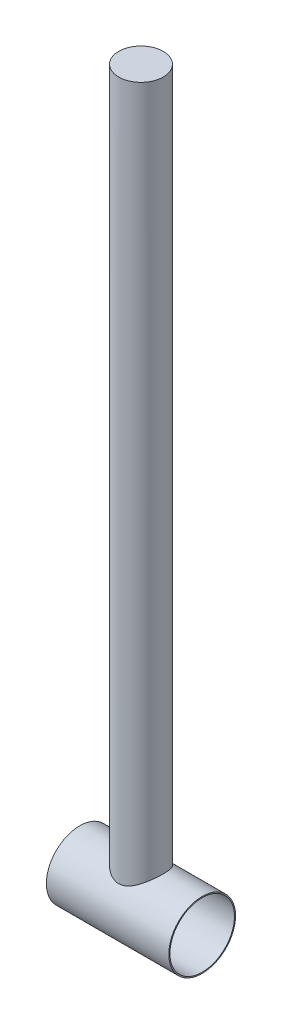
from build123d import *

# Parameters (mm, degrees)
SKETCH2_R                = 30
SKETCH2_R_2              = 29
BOSS_EXTRUDE3_DEPTH      = 55
BOSS_EXTRUDE4_REACH      = 721.462
BOSS_EXTRUDE4_END_RADIUS = 30
BOSS_EXTRUDE4_START      = 650
SKETCH1_R                = 20


with BuildPart() as part:
    # Sketch2 → Boss-Extrude3 (new, symmetric)
    with BuildSketch(Plane(origin=(0, 0, 0), x_dir=(0, 0, -1), z_dir=(1, 0, 0))):
        Circle(SKETCH2_R)
        Circle(SKETCH2_R_2, mode=Mode.SUBTRACT)
    extrude(amount=BOSS_EXTRUDE3_DEPTH, both=True)

    # Boss-Extrude4: up to this cylinder (the profile starts outside it)
    boss_extrude4_end = Plane(origin=(0, 0, 0), z_dir=(-1, 0, 0)) * Cylinder(BOSS_EXTRUDE4_END_RADIUS, 1503.924, mode=Mode.PRIVATE)
    # Sketch1 → Boss-Extrude4 (add, up to the surface)
    with BuildSketch(Plane(origin=(0, 0, 0), x_dir=(1, 0, 0), z_dir=(0, 1, 0)).offset(BOSS_EXTRUDE4_START), mode=Mode.PRIVATE) as boss_extrude4_sk1:
        with Locations(Location((0, 0, 0), (0, 0, 270))):
            Circle(SKETCH1_R)
    boss_extrude4_tool1 = extrude(boss_extrude4_sk1.sketch, amount=-BOSS_EXTRUDE4_REACH, mode=Mode.PRIVATE) - boss_extrude4_end
    add(boss_extrude4_tool1.solids().sort_by_distance((0, 650, 0))[0])


solid = part.part
